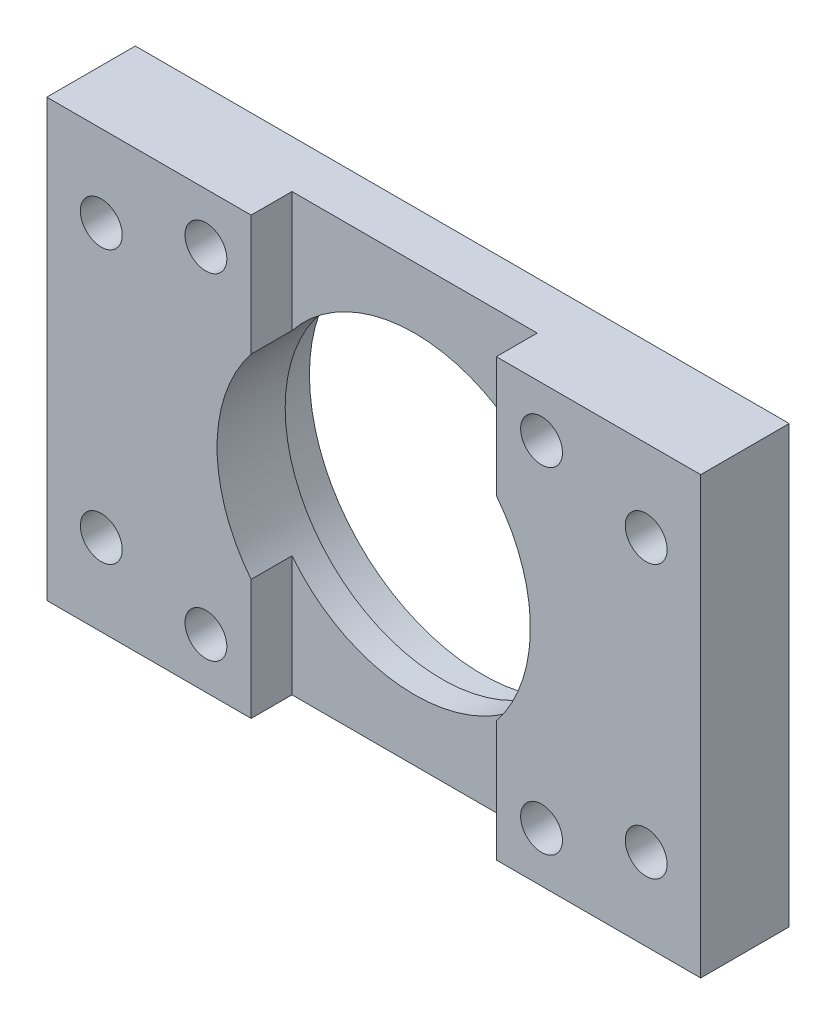
from build123d import *

# Parameters (mm, degrees)
SKETCH1_W                                       = 38.1
SKETCH1_H                                       = 25.4
BOSS_EXTRUDE1_DEPTH                             = 6.35
SKETCH6_R                                       = 9.128125
CUT_EXTRUDE1_DEPTH                              = 24.759524406
SKETCH8_W                                       = 14.2875
SKETCH8_H                                       = 25.4
CUT_EXTRUDE2_DEPTH                              = 2.38125
SKETCH14_W                                      = 38.1
SKETCH14_H                                      = 25.4
SKETCH14_R                                      = 11.3665
CUT_EXTRUDE3_DEPTH                              = 1.190625
SKETCH19_R                                      = 10.0965
CUT_EXTRUDE4_DEPTH                              = 2.38125
F_2_CLEARANCE_HOLE1_D                           = 2.4384
CBORE_FOR_2_PAN_HEAD_MACHINE_SCREW1_D           = 2.4384
CBORE_FOR_2_PAN_HEAD_MACHINE_SCREW1_CBORE_D     = 4.7625
CBORE_FOR_2_PAN_HEAD_MACHINE_SCREW1_CBORE_DEPTH = 2.38125


with BuildPart() as part:
    # Sketch1 → Boss-Extrude1 (new body)
    with BuildSketch(Plane.XY):
        Rectangle(SKETCH1_W, SKETCH1_H)
    extrude(amount=BOSS_EXTRUDE1_DEPTH)

    # Sketch6 → Cut-Extrude1 (cut, through all)
    with BuildSketch(Plane.XY.offset(6.35)):
        Circle(SKETCH6_R)
    extrude(amount=-CUT_EXTRUDE1_DEPTH, mode=Mode.SUBTRACT)

    # Sketch8 → Cut-Extrude2 (cut)
    with BuildSketch(Plane.XY.offset(6.35)):
        Rectangle(SKETCH8_W, SKETCH8_H)
    extrude(amount=-CUT_EXTRUDE2_DEPTH, mode=Mode.SUBTRACT)

    # Sketch14 → Cut-Extrude3 (cut)
    with BuildSketch(Plane(origin=(0, 0, 0), x_dir=(-1, 0, 0), z_dir=(0, 0, -1))):
        Rectangle(SKETCH14_W, SKETCH14_H)
        Circle(SKETCH14_R, mode=Mode.SUBTRACT)
    extrude(amount=-CUT_EXTRUDE3_DEPTH, mode=Mode.SUBTRACT)

    # Sketch19 → Cut-Extrude4 (cut)
    with BuildSketch(Plane(origin=(0, 0, 0), x_dir=(-1, 0, 0), z_dir=(0, 0, -1))):
        Circle(SKETCH19_R)
    extrude(amount=-CUT_EXTRUDE4_DEPTH, mode=Mode.SUBTRACT)

    # #2 Clearance Hole1 (through all)
    with Locations(Plane(origin=(0, 0, 1.190625), x_dir=(-1, 0, 0), z_dir=(0, 0, -1))):
        with Locations((-9.779, 9.779), (9.779, 9.779), (9.779, -9.779), (-9.779, -9.779)):
            Hole(F_2_CLEARANCE_HOLE1_D / 2)

    # CBORE for #2 Pan Head Machine Screw1 (through all)
    with Locations(Plane(origin=(0, 0, 1.190625), x_dir=(-1, 0, 0), z_dir=(0, 0, -1))):
        with Locations((-15.875, 7.9375), (-15.875, -7.9375), (15.875, -7.9375), (15.875, 7.9375)):
            CounterBoreHole(CBORE_FOR_2_PAN_HEAD_MACHINE_SCREW1_D / 2, CBORE_FOR_2_PAN_HEAD_MACHINE_SCREW1_CBORE_D / 2, CBORE_FOR_2_PAN_HEAD_MACHINE_SCREW1_CBORE_DEPTH)


solid = part.part
